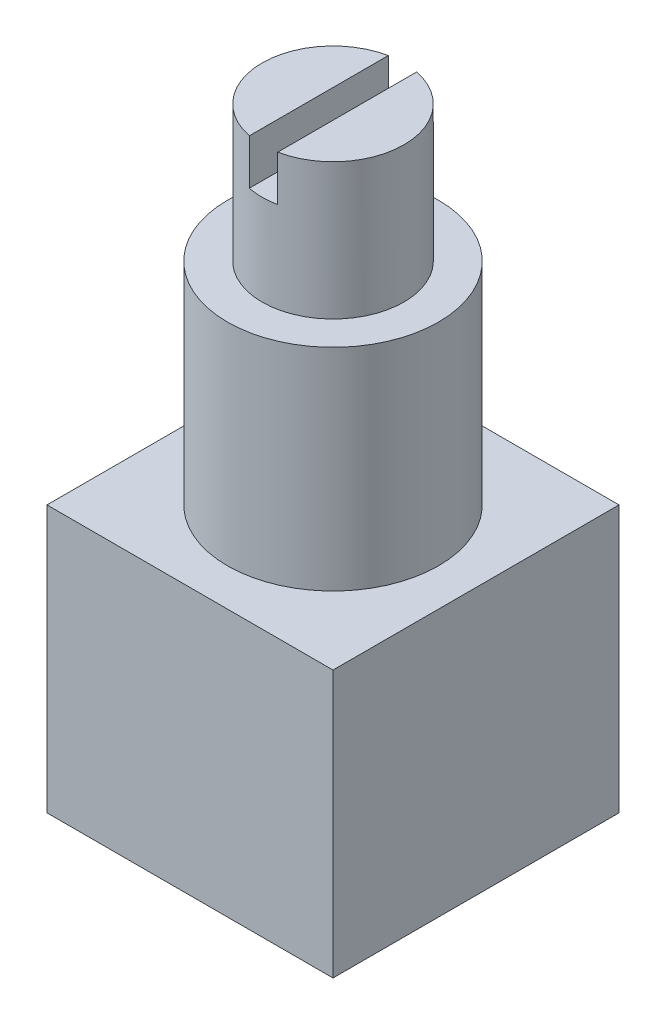
from build123d import *

# Parameters (mm, degrees)
SKETCH1_W               = 12.6
SKETCH1_H               = 12.6
BOSS_EXTRUDE1_DEPTH     = 11.75
SKETCH2_R               = 4.65
BOSS_EXTRUDE2_DEPTH     = 9.3
SKETCH3_R               = 3.125
BOSS_EXTRUDE3_DEPTH     = 6
CUT_EXTRUDE1_DEPTH      = 29.479510178
CUT_EXTRUDE1_DEPTH_BACK = 29.479510178
SKETCH4_W               = 1.25
SKETCH4_H               = 2


with BuildPart() as part:
    # Sketch1 → Boss-Extrude1 (new body)
    with BuildSketch(Plane(origin=(0, 0, 0), x_dir=(1, 0, 0), z_dir=(0, 1, 0))):
        Rectangle(SKETCH1_W, SKETCH1_H)
    extrude(amount=BOSS_EXTRUDE1_DEPTH)

    # Sketch2 → Boss-Extrude2 (add)
    with BuildSketch(Plane(origin=(0, 11.75, 0), x_dir=(1, 0, 0), z_dir=(0, 1, 0))):
        with Locations(Location((0, 0, 0), (0, 0, 270))):
            Circle(SKETCH2_R)
    extrude(amount=BOSS_EXTRUDE2_DEPTH)

    # Sketch3 → Boss-Extrude3 (add)
    with BuildSketch(Plane(origin=(0, 21.05, 0), x_dir=(1, 0, 0), z_dir=(0, 1, 0))):
        with Locations(Location((0, 0, 0), (0, 0, 270))):
            Circle(SKETCH3_R)
    extrude(amount=BOSS_EXTRUDE3_DEPTH)

    # Sketch4 → Cut-Extrude1 (cut, two sides: drawn at the far end of the back side and taken through both)
    with BuildSketch(Plane.XY.offset(-CUT_EXTRUDE1_DEPTH_BACK)):
        with Locations((0, 26.05)):
            Rectangle(SKETCH4_W, SKETCH4_H)
    extrude(amount=CUT_EXTRUDE1_DEPTH + CUT_EXTRUDE1_DEPTH_BACK, mode=Mode.SUBTRACT)


solid = part.part
